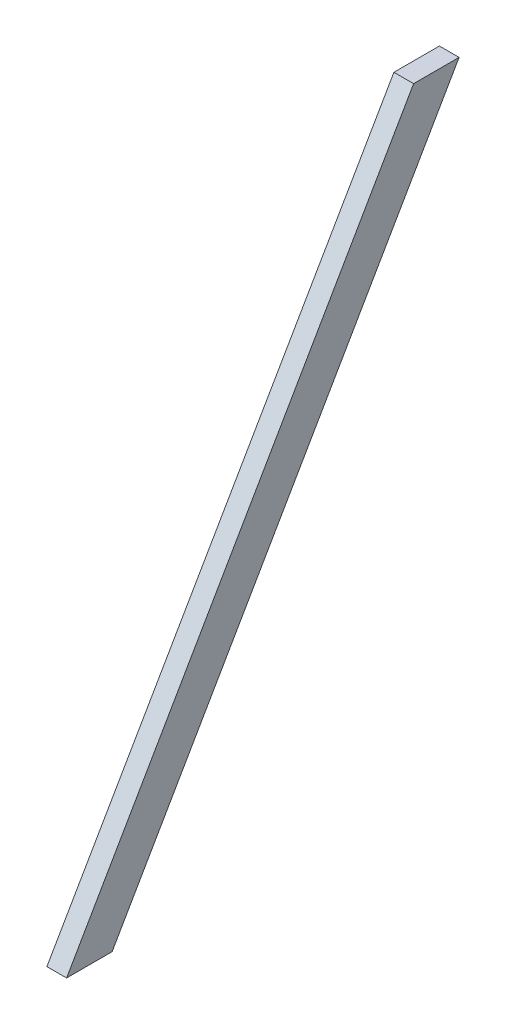
from build123d import *

# Parameters (mm, degrees)
BOSS_EXTRUDE1_DEPTH = 25.4


with BuildPart() as part:
    # Sketch1 → Boss-Extrude1 (new body)
    with BuildSketch(Plane(origin=(0, 0, 0), x_dir=(0, 0, -1), z_dir=(1, 0, 0))):
        Polygon((0, 0), (-58.65878735, 0), (388.63521265, 774.735933921), (447.294, 774.735933921), align=None)
    extrude(amount=BOSS_EXTRUDE1_DEPTH)


solid = part.part
